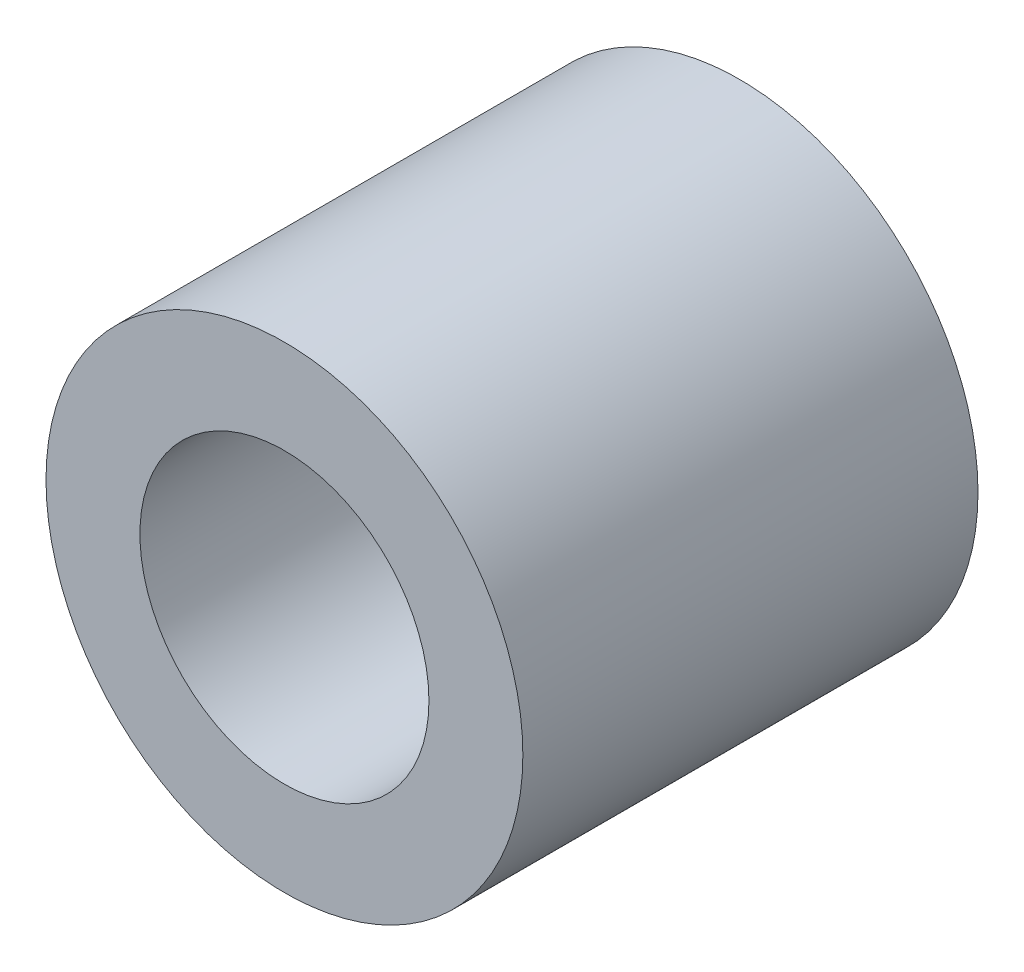
from build123d import *

# Parameters (mm, degrees)
SCHIZZO1_R                   = 10.4775
SCHIZZO1_R_2                 = 6.35
ESTRUSIONE_ESTRUSIONE1_DEPTH = 20


with BuildPart() as part:
    # Schizzo1 → Estrusione-Estrusione1 (new body)
    with BuildSketch(Plane.XY):
        Circle(SCHIZZO1_R)
        Circle(SCHIZZO1_R_2, mode=Mode.SUBTRACT)
    extrude(amount=ESTRUSIONE_ESTRUSIONE1_DEPTH)


solid = part.part
